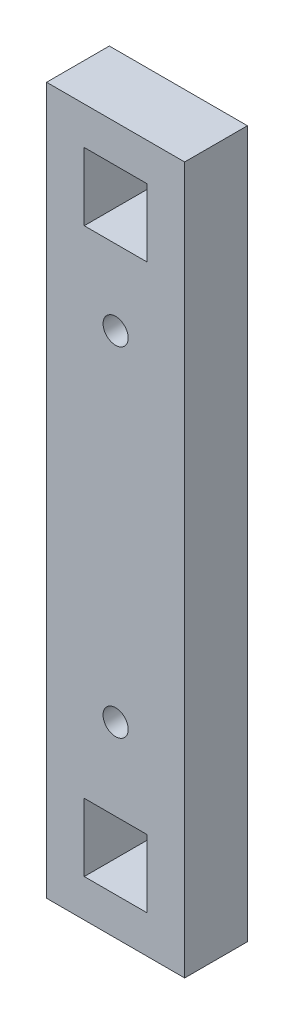
from build123d import *

# Parameters (mm, degrees)
ESQUISSE1_W        = 11
ESQUISSE1_H        = 56.3
ESQUISSE1_R        = 1
ESQUISSE1_W_2      = 5
ESQUISSE1_H_2      = 5.4
BOSS_EXTRU_1_DEPTH = 5


with BuildPart() as part:
    # Esquisse1 → Boss.-Extru.1 (new body)
    with BuildSketch(Plane.XY):
        with Locations((-1.488022113, -13.090909091)):
            Rectangle(ESQUISSE1_W, ESQUISSE1_H)
        with Locations((-1.488022113, 0.659090909)):
            Circle(ESQUISSE1_R, mode=Mode.SUBTRACT)
        with Locations((-1.488022113, -26.340909091)):
            Circle(ESQUISSE1_R, mode=Mode.SUBTRACT)
        with Locations((-1.488022113, 9.359090909)):
            Rectangle(ESQUISSE1_W_2, ESQUISSE1_H_2, mode=Mode.SUBTRACT)
        with Locations((-1.488022113, -35.540909091)):
            Rectangle(ESQUISSE1_W_2, ESQUISSE1_H_2, mode=Mode.SUBTRACT)
    extrude(amount=BOSS_EXTRU_1_DEPTH)


solid = part.part
